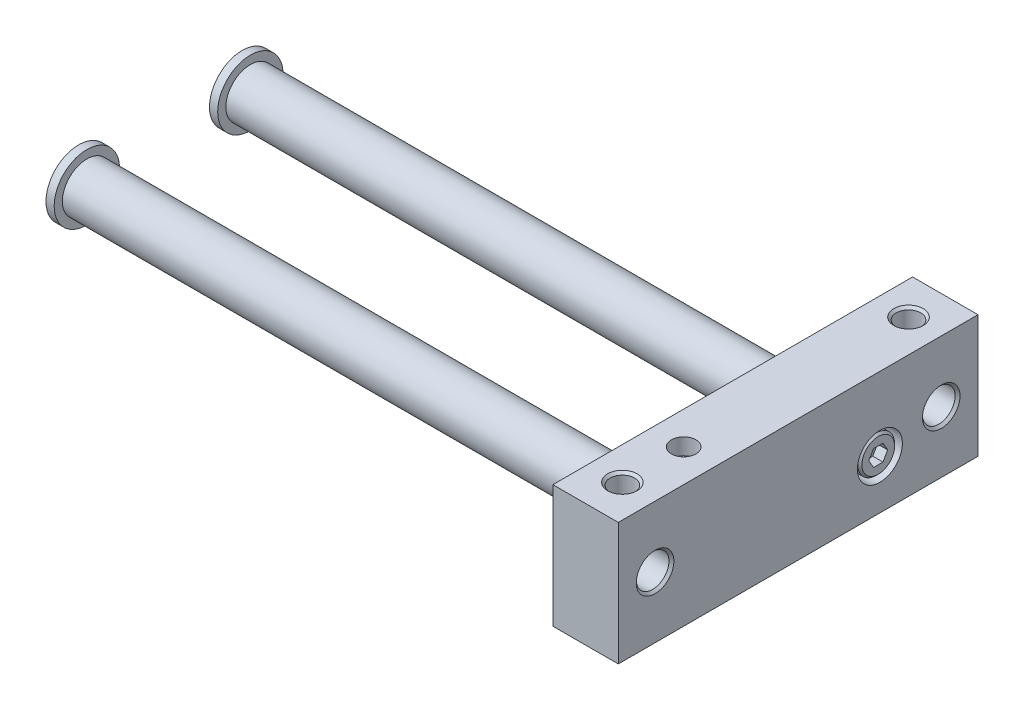
from build123d import *

# Parameters (mm, degrees)
PLATE_SKETCH_W               = 44
PLATE_SKETCH_H               = 15
PLATE_DEPTH                  = 8
TAPPED_HOLE_FACE_D           = 4
TAPPED_HOLE_FACE_CSINK_D     = 4.6
TAPPED_HOLE_FACE_CSINK_ANGLE = 90
RODS_DEPTH                   = 60
RODS_DEPTH_BACK              = 17
RODS_SKETCH_R                = 3
PISTON_SKETCH_R              = 4
PISTON_DEPTH                 = 1
TAPPED_HOLES_TOP_AT_2_COUNT  = 2
TAPPED_HOLES_TOP_AT_2_PITCH  = 35
SHCS_SEAT_SKETCH_R           = 2.75
SHCS_SEAT_DEPTH              = 2.7
SHCS_HEAD_SKETCH_R           = 2.25
SHCS_HEAD_DEPTH              = 2.5
SHCS_HEX_DEPTH               = 1.25
SHCS_CHAM_SIZE               = 0.25
SS_SEAT_SKETCH_R             = 1.5
SS_SEAT_DEPTH                = 2
SS_HEX_DEPTH                 = 1.5


with BuildPart() as part:
    # Plate_Sketch → Plate (new body)
    with BuildSketch(Plane(origin=(0, 0, 0), x_dir=(0, 0, -1), z_dir=(1, 0, 0))):
        Rectangle(PLATE_SKETCH_W, PLATE_SKETCH_H)
    extrude(amount=PLATE_DEPTH)

    # Tapped Hole Face (through all)
    with Locations(Plane(origin=(8, 0, 0), x_dir=(0, 0, -1), z_dir=(1, 0, 0))):
        with Locations((-17.5, 0), (17.5, 0)):
            CounterSinkHole(TAPPED_HOLE_FACE_D / 2, TAPPED_HOLE_FACE_CSINK_D / 2, counter_sink_angle=TAPPED_HOLE_FACE_CSINK_ANGLE)

    # Rods_Sketch → Rods (add, two sides: drawn at the far end of the back side and taken through both)
    with BuildSketch(Plane.ZY.offset(9).offset(-RODS_DEPTH_BACK)):
        with Locations((-10, -1.5)):
            Circle(RODS_SKETCH_R)
        with Locations(Location((10, -1.5, 0), (0, 0, 180))):
            Circle(RODS_SKETCH_R)
    extrude(amount=RODS_DEPTH + RODS_DEPTH_BACK)

    # Piston_Sketch → Piston (add)
    with BuildSketch(Plane.ZY.offset(69)):
        with Locations((-10, -1.5)):
            Circle(PISTON_SKETCH_R)
        with Locations((10, -1.5)):
            Circle(PISTON_SKETCH_R)
    extrude(amount=PISTON_DEPTH)

    # Tapped Holes Top Profile → Tapped Holes Top (revolve, cut)
    with BuildSketch(Plane(origin=(4, 7.5, -17.5), x_dir=(0, 0, 1), z_dir=(1, 0, 0))):
        Polygon((0, 0), (0, 5.420408726), (1.25, 5.2), (1.25, 5), (1.5, 5), (1.5, 0.3), (1.8, 0), align=None)
    tapped_holes_top = revolve(axis=Axis((4, 13.85, -17.5), (0, -1, 0)), mode=Mode.SUBTRACT)

    # Tapped Holes Top at 2: Tapped Holes Top ×2
    with Locations(*[(0, 0, i * TAPPED_HOLES_TOP_AT_2_PITCH) for i in range(1, TAPPED_HOLES_TOP_AT_2_COUNT)]):
        add(tapped_holes_top, mode=Mode.SUBTRACT)

    # Tapped Holes Top Mirror: Tapped Holes Top across plane
    add(tapped_holes_top.mirror(Plane.ZX), mode=Mode.SUBTRACT)

    # Tapped Holes Top Mirror copy 1 sketch → Tapped Holes Top Mirror copy 1 (revolve, cut)
    with BuildSketch(Plane(origin=(4, -7.5, 17.5), x_dir=(0, 0, 1), z_dir=(1, 0, 0))):
        Polygon((0, 0), (0, -5.420408726), (1.25, -5.2), (1.25, -5), (1.5, -5), (1.5, -0.3), (1.8, 0), align=None)
    revolve(axis=Axis((4, -13.85, 17.5), (0, -1, 0)), mode=Mode.SUBTRACT)

    # SHCS Seat_Sketch → SHCS Seat (cut)
    with BuildSketch(Plane(origin=(8, 0, 0), x_dir=(0, 0, -1), z_dir=(1, 0, 0))):
        with Locations((10, -1.5)):
            Circle(SHCS_SEAT_SKETCH_R)
    extrude(amount=-SHCS_SEAT_DEPTH, mode=Mode.SUBTRACT)

    # SHCS Head_Sketch → SHCS Head (add)
    with BuildSketch(Plane(origin=(5.3, 0, 0), x_dir=(0, 0, -1), z_dir=(1, 0, 0))):
        with Locations((10, -1.5)):
            Circle(SHCS_HEAD_SKETCH_R)
    extrude(amount=SHCS_HEAD_DEPTH)

    # SHCS Hex_Sketch → SHCS Hex (cut)
    with BuildSketch(Plane(origin=(7.8, 0, 0), x_dir=(0, 0, -1), z_dir=(1, 0, 0))):
        Polygon((10.577350269, -2.5), (11.154700538, -1.5), (10.577350269, -0.5), (9.422649731, -0.5), (8.845299462, -1.5), (9.422649731, -2.5), align=None)
    extrude(amount=-SHCS_HEX_DEPTH, mode=Mode.SUBTRACT)

    # SHCS Cham
    shcs_cham_edges = [part.edges().sort_by_distance(p)[0] for p in [
        (7.8, -1.5, -7.75),
    ]]
    chamfer(shcs_cham_edges, length=SHCS_CHAM_SIZE)

    # SS Seat_Sketch → SS Seat (cut)
    with BuildSketch(Plane(origin=(0, 7.5, 0), x_dir=(-1, 0, 0), z_dir=(0, 1, 0))):
        with Locations(Location((-4, 10, 0), (0, 0, 90))):
            Circle(SS_SEAT_SKETCH_R)
    extrude(amount=-SS_SEAT_DEPTH, mode=Mode.SUBTRACT)

    # SS Hex_Sketch → SS Hex (cut)
    with BuildSketch(Plane(origin=(0, 5.5, 0), x_dir=(-1, 0, 0), z_dir=(0, 1, 0))):
        Polygon((-4.75, 9.566987298), (-4, 9.133974596), (-3.25, 9.566987298), (-3.25, 10.433012702), (-4, 10.866025404), (-4.75, 10.433012702), align=None)
    extrude(amount=-SS_HEX_DEPTH, mode=Mode.SUBTRACT)


solid = part.part
